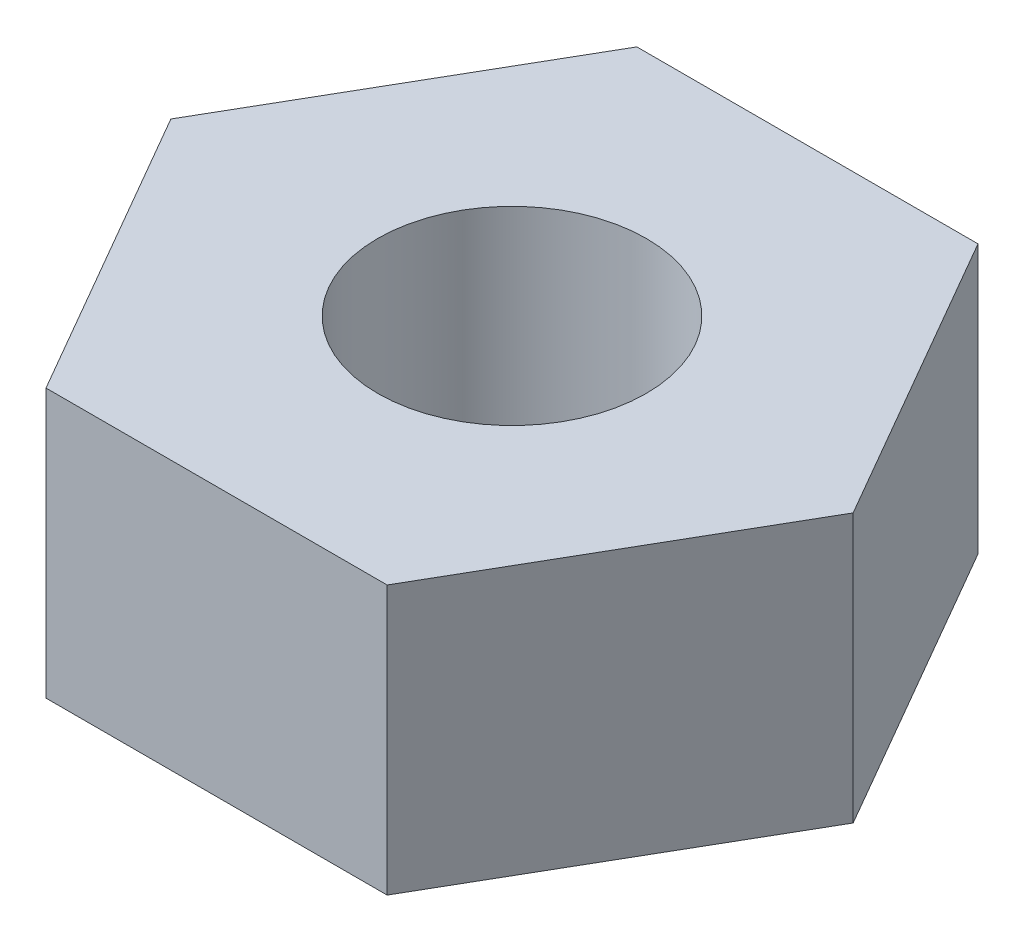
from build123d import *

# Parameters (mm, degrees)
BOSS_EXTRUDE1_DEPTH = 1.25
M3_TAPPED_HOLE1_D   = 2.5


with BuildPart() as part:
    # Sketch1 → Boss-Extrude1 (new, symmetric)
    with BuildSketch(Plane(origin=(0, 0, 0), x_dir=(1, 0, 0), z_dir=(0, 1, 0))):
        Polygon((3.175426481, 0), (1.58771324, 2.75), (-1.58771324, 2.75), (-3.175426481, 0), (-1.58771324, -2.75), (1.58771324, -2.75), align=None)
    extrude(amount=BOSS_EXTRUDE1_DEPTH, both=True)

    # M3 Tapped Hole1 (through all)
    with Locations(Plane(origin=(0, 1.25, 0), x_dir=(1, 0, 0), z_dir=(0, 1, 0))):
        with Locations((0, 0)):
            Hole(M3_TAPPED_HOLE1_D / 2)


solid = part.part
